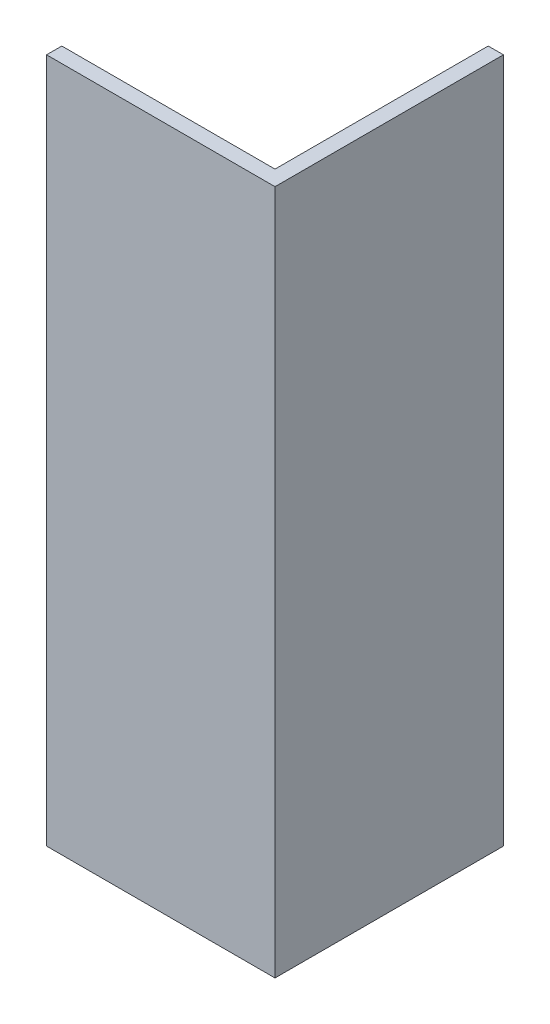
from build123d import *

# Parameters (mm, degrees)
BOSS_EXTRUDE1_DEPTH = 9


with BuildPart() as part:
    # Sketch1 → Boss-Extrude1 (new body)
    with BuildSketch(Plane(origin=(0, 0, 0), x_dir=(1, 0, 0), z_dir=(0, 1, 0))):
        Polygon((0, 0), (0, 0.2), (2.8, 0.2), (2.8, 3), (3, 3), (3, 0), align=None)
    extrude(amount=BOSS_EXTRUDE1_DEPTH)


solid = part.part
